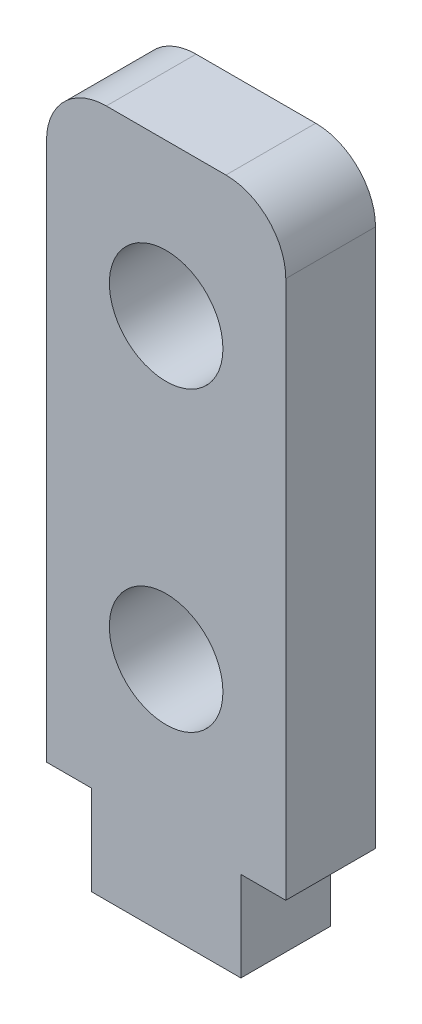
from build123d import *

# Parameters (mm, degrees)
SKETCH1_W             = 8
SKETCH1_H             = 20
SKETCH1_W_2           = 5
SKETCH1_H_2           = 3
BOSS_EXTRUDE1_DEPTH   = 3
F_6_CLEARANCE_HOLE1_D = 3.7973
FILLET1_R             = 2


with BuildPart() as part:
    # Sketch1 → Boss-Extrude1 (new body)
    with BuildSketch(Plane.XY):
        with Locations((0, 13)):
            Rectangle(SKETCH1_W, SKETCH1_H)
        with Locations((0, 1.5)):
            Rectangle(SKETCH1_W_2, SKETCH1_H_2)
    extrude(amount=BOSS_EXTRUDE1_DEPTH)

    # #6 Clearance Hole1 (through all)
    with Locations(Plane.XY.offset(3)):
        with Locations((0, 17.92), (0, 7.98)):
            Hole(F_6_CLEARANCE_HOLE1_D / 2)

    # Fillet1
    fillet1_edges = [part.edges().sort_by_distance(p)[0] for p in [
        (-4, 23, 1.5),
        (4, 23, 1.5),
    ]]
    fillet(fillet1_edges, radius=FILLET1_R)


solid = part.part
